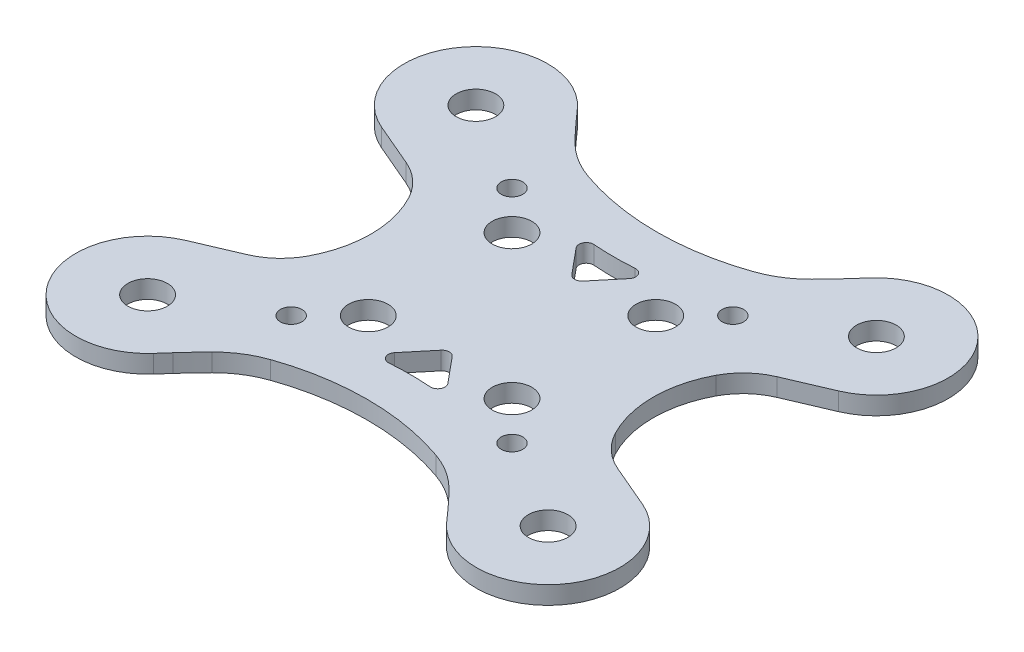
from build123d import *

# Parameters (mm, degrees)
SKETCH2_R           = 1.5
SKETCH2_R_2         = 2.75
BOSS_EXTRUDE1_DEPTH = 2.5


with BuildPart() as part:
    # Sketch2 → Boss-Extrude1 (new body)
    with BuildSketch(Plane(origin=(0, 0, 0), x_dir=(1, 0, 0), z_dir=(0, 1, 0))):
        with BuildLine():
            Line((-20.402989885, -29.497935256), (-19.112268572, -28.051458372))
            ThreePointArc((-19.112268572, -28.051458372), (-17.810696545, -26.629075982), (-16.473919979, -25.239727278))
            ThreePointArc((-16.473919979, -25.239727278), (-14.160863056, -23.377992793), (-11.485697638, -22.089669229))
            ThreePointArc((-11.485697638, -22.089669229), (0, -20.15141071), (11.485697638, -22.089669229))
            ThreePointArc((11.485697638, -22.089669229), (14.160863056, -23.377992793), (16.473919979, -25.239727278))
            ThreePointArc((16.473919979, -25.239727278), (17.810696545, -26.629075982), (19.112268572, -28.051458372))
            Line((19.112268572, -28.051458372), (20.402989885, -29.497935256))
            ThreePointArc((20.402989885, -29.497935256), (35.984508278, -28.676365345), (31.796806607, -13.645668513))
            Line((31.796806607, -13.645668513), (25.794436634, -11.078432427))
            ThreePointArc((25.794436634, -11.078432427), (23.235962273, -9.423067761), (21.376539879, -7.008824278))
            ThreePointArc((21.376539879, -7.008824278), (19.638379202, 0), (21.376539879, 7.008824278))
            ThreePointArc((21.376539879, 7.008824278), (23.235962273, 9.423067761), (25.794436634, 11.078432427))
            Line((25.794436634, 11.078432427), (31.796806607, 13.645668513))
            ThreePointArc((31.796806607, 13.645668513), (35.984508278, 28.676365345), (20.402989885, 29.497935256))
            Line((20.402989885, 29.497935256), (19.112268572, 28.051458372))
            ThreePointArc((19.112268572, 28.051458372), (17.810696545, 26.629075982), (16.473919979, 25.239727278))
            ThreePointArc((16.473919979, 25.239727278), (14.160863056, 23.377992793), (11.485697638, 22.089669229))
            ThreePointArc((11.485697638, 22.089669229), (0, 20.15141071), (-11.485697638, 22.089669229))
            ThreePointArc((-11.485697638, 22.089669229), (-14.160863056, 23.377992793), (-16.473919979, 25.239727278))
            ThreePointArc((-16.473919979, 25.239727278), (-17.810696545, 26.629075982), (-19.112268572, 28.051458372))
            Line((-19.112268572, 28.051458372), (-20.402989885, 29.497935256))
            ThreePointArc((-20.402989885, 29.497935256), (-35.984508278, 28.676365345), (-31.796806607, 13.645668513))
            Line((-31.796806607, 13.645668513), (-25.794436634, 11.078432427))
            ThreePointArc((-25.794436634, 11.078432427), (-23.235962273, 9.423067761), (-21.376539879, 7.008824278))
            ThreePointArc((-21.376539879, 7.008824278), (-19.638379202, 0), (-21.376539879, -7.008824278))
            ThreePointArc((-21.376539879, -7.008824278), (-23.235962273, -9.423067761), (-25.794436634, -11.078432427))
            Line((-25.794436634, -11.078432427), (-31.796806607, -13.645668513))
            ThreePointArc((-31.796806607, -13.645668513), (-35.984508278, -28.676365345), (-20.402989885, -29.497935256))
        make_face()
        with Locations(Location((15.365, -15.365, 0), (0, 0, 270))):
            Circle(SKETCH2_R, mode=Mode.SUBTRACT)
        with Locations(Location((27.864354565, 22.840004863, 0), (0, 0, 270))):
            Circle(SKETCH2_R_2, mode=Mode.SUBTRACT)
        with Locations(Location((-15.365, 15.365, 0), (0, 0, 270))):
            Circle(SKETCH2_R, mode=Mode.SUBTRACT)
        with Locations(Location((15.365, 15.365, 0), (0, 0, 270))):
            Circle(SKETCH2_R, mode=Mode.SUBTRACT)
        with Locations(Location((-15.365, -15.365, 0), (0, 0, 270))):
            Circle(SKETCH2_R, mode=Mode.SUBTRACT)
        with Locations(Location((27.864354565, -22.840004863, 0), (0, 0, 270))):
            Circle(SKETCH2_R_2, mode=Mode.SUBTRACT)
        with Locations(Location((10.000016395, -10.000011804, 0), (0, 0, 270))):
            Circle(SKETCH2_R_2, mode=Mode.SUBTRACT)
        with Locations(Location((-27.864354565, 22.840004863, 0), (0, 0, 270))):
            Circle(SKETCH2_R_2, mode=Mode.SUBTRACT)
        with Locations(Location((-27.864354565, -22.840004863, 0), (0, 0, 270))):
            Circle(SKETCH2_R_2, mode=Mode.SUBTRACT)
        with Locations(Location((-10.000016395, -10.000011804, 0), (0, 0, 270))):
            Circle(SKETCH2_R_2, mode=Mode.SUBTRACT)
        with Locations(Location((-10.000016395, 10.000011804, 0), (0, 0, 270))):
            Circle(SKETCH2_R_2, mode=Mode.SUBTRACT)
        with Locations(Location((10.000016395, 10.000011804, 0), (0, 0, 270))):
            Circle(SKETCH2_R_2, mode=Mode.SUBTRACT)
        with BuildLine():
            Line((3.71054333, -12.635244665), (0.769622246, -9.090373716))
            ThreePointArc((0.769622246, -9.090373716), (0, -8.728873205), (-0.769622246, -9.090373716))
            Line((-0.769622246, -9.090373716), (-3.71054333, -12.635244665))
            ThreePointArc((-3.71054333, -12.635244665), (-3.829359507, -13.73273998), (-2.865512851, -14.2708969))
            ThreePointArc((-2.865512851, -14.2708969), (0, -14.16270124), (2.865512851, -14.2708969))
            ThreePointArc((2.865512851, -14.2708969), (3.829359508, -13.73273998), (3.71054333, -12.635244665))
        make_face(mode=Mode.SUBTRACT)
        with BuildLine():
            Line((-3.71054333, 12.635244665), (-0.769622246, 9.090373716))
            ThreePointArc((-0.769622246, 9.090373716), (0, 8.728873205), (0.769622246, 9.090373716))
            Line((0.769622246, 9.090373716), (3.71054333, 12.635244665))
            ThreePointArc((3.71054333, 12.635244665), (3.829359507, 13.73273998), (2.865512851, 14.2708969))
            ThreePointArc((2.865512851, 14.2708969), (0, 14.16270124), (-2.865512851, 14.2708969))
            ThreePointArc((-2.865512851, 14.2708969), (-3.829359508, 13.73273998), (-3.71054333, 12.635244665))
        make_face(mode=Mode.SUBTRACT)
    extrude(amount=BOSS_EXTRUDE1_DEPTH)


solid = part.part
